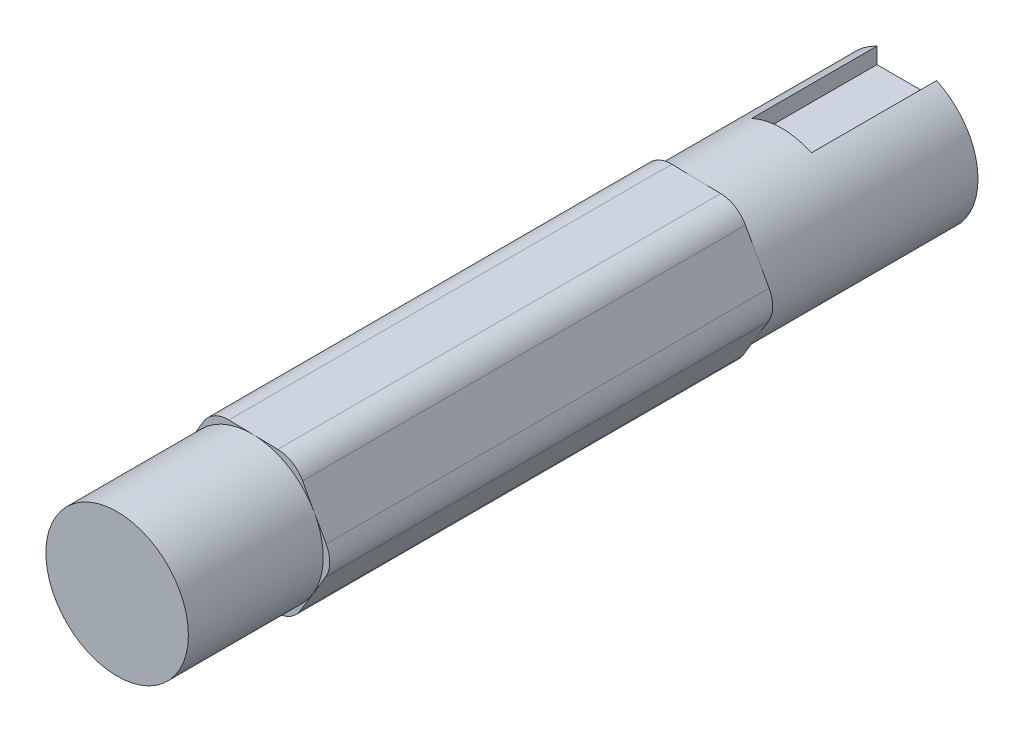
from build123d import *

# Parameters (mm, degrees)
BOSS_EXTRUDE1_DEPTH      = 37
BOSS_EXTRUDE1_DEPTH_BACK = 45
SKETCH1_R                = 7.4
SKETCH4_W                = 6.2
SKETCH4_H                = 4.7
CUT_EXTRUDE1_DEPTH       = 13
BOSS_EXTRUDE2_DEPTH      = 46
FILLET1_R                = 3


with BuildPart() as part:
    # Sketch1 → Boss-Extrude1 (new, two sides: drawn at the far end of the back side and taken through both)
    with BuildSketch(Plane.XY.offset(-BOSS_EXTRUDE1_DEPTH_BACK)):
        Circle(SKETCH1_R)
    extrude(amount=BOSS_EXTRUDE1_DEPTH + BOSS_EXTRUDE1_DEPTH_BACK)

    # Sketch4 → Cut-Extrude1 (cut)
    with BuildSketch(Plane(origin=(0, 0, -45), x_dir=(-1, 0, 0), z_dir=(0, 0, -1))):
        with Locations((0, 7.4)):
            Rectangle(SKETCH4_W, SKETCH4_H)
    extrude(amount=-CUT_EXTRUDE1_DEPTH, mode=Mode.SUBTRACT)

    # Sketch5 → Boss-Extrude2 (add)
    with BuildSketch(Plane.XY.offset(-23)):
        Polygon((4.419750831, 7.312943041), (-4.123319035, 7.484088019), (-8.543069866, 0.171144977), (-4.419750831, -7.312943041), (4.123319035, -7.484088019), (8.543069866, -0.171144977), align=None)
    extrude(amount=BOSS_EXTRUDE2_DEPTH)

    # Fillet1
    fillet1_edges = [part.edges().sort_by_distance(p)[0] for p in [
        (8.543069866, -0.171144977, 0),
        (4.419750831, 7.312943041, 0),
        (-4.123319035, 7.484088019, 0),
        (-8.543069866, 0.171144977, 0),
        (-4.419750831, -7.312943041, 0),
        (4.123319035, -7.484088019, 0),
    ]]
    fillet(fillet1_edges, radius=FILLET1_R)


solid = part.part
